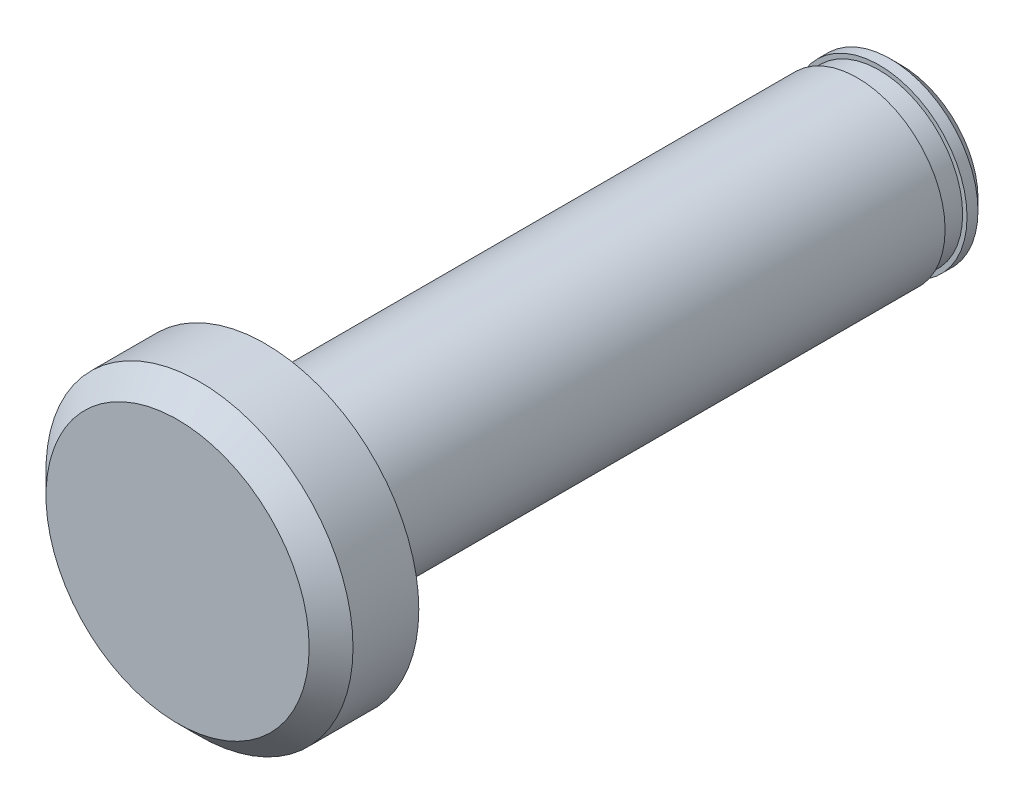
from build123d import *


with BuildPart() as part:
    # Esquisse3 → Base-Révolution (revolve)
    with BuildSketch(Plane(origin=(0, 0, 0), x_dir=(1, 0, 0), z_dir=(0, 1, 0)), mode=Mode.PRIVATE) as base_r_volution_sk:
        Polygon((-14.488580903, -38.951150448), (-8.488580903, -38.951150448), (-8.488580903, -5.951150448), (-11.988580903, -5.951150448), (-12.488580903, -6.451150448), (-12.488580903, -6.951150448), (-12.288580903, -6.951150448), (-12.288580903, -7.951150448), (-12.488580903, -7.951150448), (-12.488580903, -34.951150448), (-15.488580903, -34.951150448), (-15.488580903, -37.951150448), align=None)
    revolve(base_r_volution_sk.sketch.rotate(Axis((-8.488580903, 0, 56.293331626), (0, 0, -1)), 180), axis=Axis((-8.488580903, 0, 56.293331626), (0, 0, -1)))


solid = part.part
